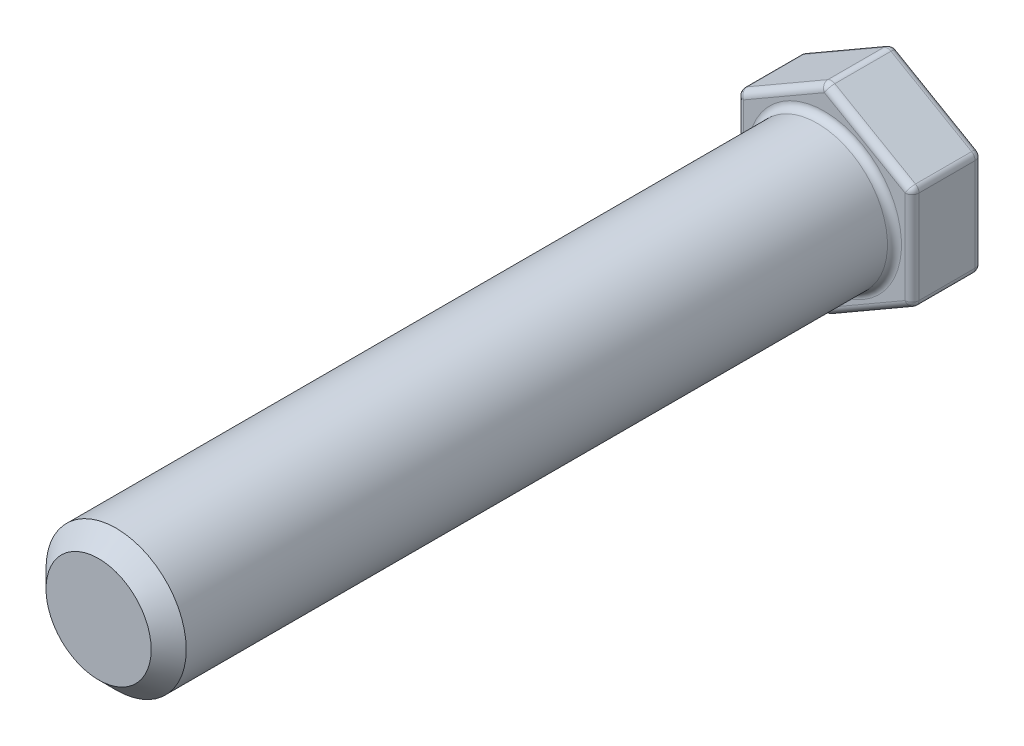
from build123d import *

# Parameters (mm, degrees)
SKETCH1_R           = 2
BOSS_EXTRUDE1_DEPTH = 20.7
BOSS_EXTRUDE2_DEPTH = 2
FILLET1_R           = 0.2
FILLET2_R           = 0.2
CHAMFER1_SIZE       = 0.5


with BuildPart() as part:
    # Sketch1 → Boss-Extrude1 (new body)
    with BuildSketch(Plane.XY):
        Circle(SKETCH1_R)
    extrude(amount=BOSS_EXTRUDE1_DEPTH)

    # Sketch2 → Boss-Extrude2 (add)
    with BuildSketch(Plane(origin=(0, 0, 0), x_dir=(-1, 0, 0), z_dir=(0, 0, -1))):
        Polygon((-2.5, 1.443375673), (-2.5, -1.443375673), (0, -2.886751346), (2.5, -1.443375673), (2.5, 1.443375673), (0, 2.886751346), align=None)
    extrude(amount=BOSS_EXTRUDE2_DEPTH)

    # Fillet1
    fillet1_edges = [part.edges().sort_by_distance(p)[0] for p in [
        (1.25, 2.165063509, 0),
        (2.5, 0, 0),
        (1.25, -2.165063509, 0),
        (-1.25, -2.165063509, 0),
        (-2.5, 0, 0),
        (-1.25, 2.165063509, 0),
        (1.25, 2.165063509, -2),
        (2.5, 0, -2),
        (1.25, -2.165063509, -2),
        (-1.25, -2.165063509, -2),
        (-2.5, 0, -2),
        (-1.25, 2.165063509, -2),
        (-2, 0, 0),
    ]]
    fillet(fillet1_edges, radius=FILLET1_R)

    # Fillet2
    fillet2_edges = [part.edges().sort_by_distance(p)[0] for p in [
        (2.5, -1.443375673, -1),
        (2.5, 1.443375673, -1),
        (0, -2.886751346, -1),
        (-2.5, -1.443375673, -1),
        (-2.5, 1.443375673, -1),
        (0, 2.886751346, -1),
        (-2.436285816, 1.406590271, -0.05362317),
        (-2.436285816, -1.406590271, -0.05362317),
        (0, 2.813180543, -0.05362317),
        (0, -2.813180543, -0.05362317),
        (2.436285816, 1.406590271, -0.05362317),
        (2.436285816, -1.406590271, -0.05362317),
        (0, -2.813180543, -1.94637683),
        (2.436285816, -1.406590271, -1.94637683),
        (-2.436285816, -1.406590271, -1.94637683),
        (2.436285816, 1.406590271, -1.94637683),
        (-2.436285816, 1.406590271, -1.94637683),
        (0, 2.813180543, -1.94637683),
    ]]
    fillet(fillet2_edges, radius=FILLET2_R)

    # Chamfer1
    chamfer1_edges = [part.edges().sort_by_distance(p)[0] for p in [
        (-2, 0, 20.7),
    ]]
    chamfer(chamfer1_edges, length=CHAMFER1_SIZE)


solid = part.part
